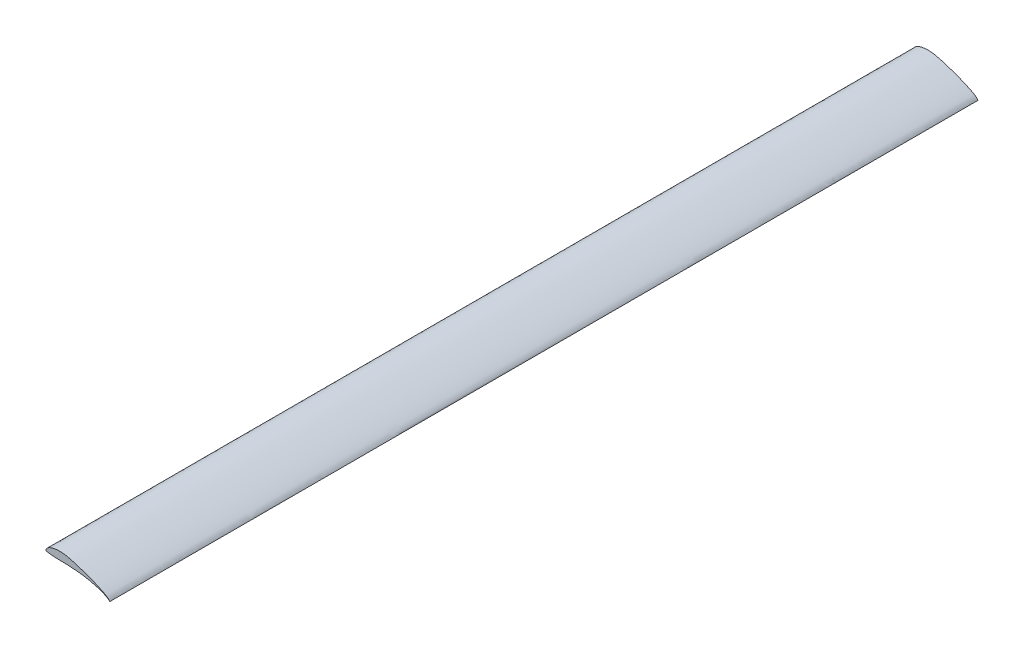
from build123d import *

# Parameters (mm, degrees)
BOSS_EXTRUDE1_DEPTH = 200


with BuildPart() as part:
    # Sketch1 → Boss-Extrude1 (new body)
    with BuildSketch(Plane.XY):
        with BuildLine():
            add(Edge.make_bspline(
                [(15.607355601, -1.568284177), (15.607520579, -1.567928289), (15.566635526, -1.521997924), (15.534044249, -1.473509878), (15.460591382, -1.371125118), (15.37193513, -1.260041439), (15.244062394, -1.140128161), (15.079978604, -1.015647512), (14.878959346, -0.87960408), (14.641079171, -0.73333104), (14.367401753, -0.577734677), (14.059279406, -0.413955073), (13.718455488, -0.242822135), (13.346738886, -0.065635228), (12.946230811, 0.116444436), (12.519312768, 0.302304316), (12.068610401, 0.490900194), (11.596635609, 0.680536195), (11.106449413, 0.870449839), (10.600751763, 1.058939547), (10.08295332, 1.245467582), (9.556348631, 1.428722365), (9.024811645, 1.607666695), (8.492798515, 1.781874736), (7.964496997, 1.948852996), (7.444089606, 2.106651288), (6.93474389, 2.251768089), (6.438990147, 2.381532882), (5.958991597, 2.492335579), (5.497713054, 2.586064711), (5.054228289, 2.65387012), (4.627993084, 2.693969755), (4.218182239, 2.710944927), (3.824664127, 2.704640877), (3.448782286, 2.679624648), (3.09239992, 2.637326696), (2.757470015, 2.580050337), (2.446052499, 2.508047758), (2.159605906, 2.423782593), (1.899856485, 2.328528452), (1.668647095, 2.223921485), (1.466698203, 2.113039899), (1.296172739, 1.993773878), (1.158001069, 1.867268796), (1.048767135, 1.739008562), (0.969569268, 1.612182746), (0.919204633, 1.490440266), (0.901811772, 1.382284262), (0.909161214, 1.278288812), (1.001692199, 1.208359237), (1.138204864, 1.173107038), (1.325516025, 1.12761264), (1.564898997, 1.088977304), (1.851963385, 1.049456639), (2.184122723, 1.012443891), (2.55790106, 0.977943733), (2.971696773, 0.947197561), (3.427222725, 0.929519107), (3.926164358, 0.922236856), (4.46876715, 0.914394836), (5.051959959, 0.90399719), (5.671316174, 0.887401808), (6.321625488, 0.861517498), (6.997295534, 0.823888024), (7.691940463, 0.772104241), (8.398950597, 0.704869592), (9.111098426, 0.620154089), (9.821041532, 0.51785697), (10.521110217, 0.397820398), (11.203500781, 0.260330867), (11.860565875, 0.106756159), (12.484824839, -0.060935806), (13.068777835, -0.240695606), (13.605783796, -0.428871834), (14.089096265, -0.62182399), (14.513450336, -0.815339229), (14.871680668, -1.002669284), (15.159271516, -1.183091579), (15.359631756, -1.335262783), (15.503246583, -1.467388566), (15.558359958, -1.518423669), (15.60718727, -1.568647299), (15.607355601, -1.568284177)],
                knots=[0, 0, 0, 0, 0.000979678, 0.003648862, 0.007483499, 0.012095277, 0.017525591, 0.02405178, 0.031783051, 0.040677828, 0.050710301, 0.061833229, 0.07398925, 0.087118173, 0.101145049, 0.115990637, 0.131570422, 0.147788379, 0.164550917, 0.181757895, 0.199311955, 0.217095072, 0.234990228, 0.252856883, 0.270540594, 0.287886779, 0.304773438, 0.321101419, 0.336806063, 0.351800033, 0.366031063, 0.379615675, 0.392652963, 0.405170359, 0.417171919, 0.428603517, 0.439418959, 0.449596586, 0.459102079, 0.467907878, 0.475988301, 0.483308969, 0.489874508, 0.49580325, 0.501149412, 0.505903073, 0.510046769, 0.513579311, 0.516446927, 0.519350053, 0.523823355, 0.529973794, 0.537715654, 0.546967844, 0.557637367, 0.569620481, 0.582804124, 0.597246961, 0.613135037, 0.6304436, 0.649056124, 0.668822257, 0.689594964, 0.711189651, 0.733426689, 0.756094118, 0.778988554, 0.801889683, 0.824566598, 0.846792285, 0.868338291, 0.888978163, 0.908492011, 0.926658768, 0.943286193, 0.95816921, 0.971135822, 0.981955623, 0.990251791, 0.995852565, 0.999000406, 1, 1, 1, 1], degree=3))
        make_face()
    extrude(amount=BOSS_EXTRUDE1_DEPTH)


solid = part.part
